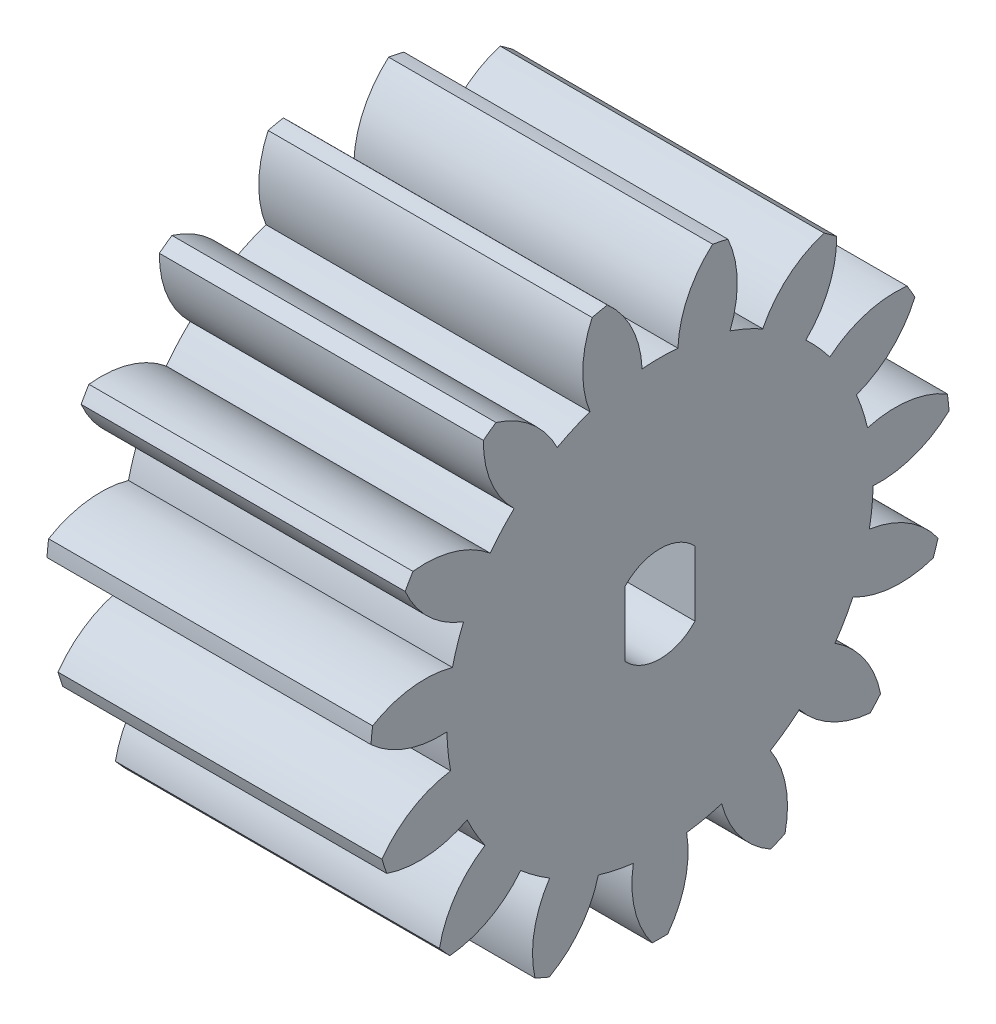
from build123d import *

# Parameters (mm, degrees)
BASPROSKE_W        = 19
BASPROSKE_H        = 17
TOOTHCUT_DEPTH     = 31.643106892
TEETHCUTS_COUNT    = 15
TEETHCUTS_ANGLE    = 336
BORSKE_R           = 0.4
BORE_DEPTH         = 50.0000508
CUT_EXTRUDE1_REACH = 32.615


with BuildPart() as part:
    # BasProSke → Base-Revolve (revolve)
    with BuildSketch(Plane(origin=(0, 0, 0), x_dir=(1, 0, 0), z_dir=(0, 1, 0)), mode=Mode.PRIVATE) as base_revolve_sk:
        with Locations((9.5, 8.5)):
            Rectangle(BASPROSKE_W, BASPROSKE_H)
    revolve(base_revolve_sk.sketch.rotate(Axis((-10, 0, 0), (1, 0, 0)), 180), axis=Axis((-10, 0, 0), (1, 0, 0)))

    # TooCutSke → ToothCut (cut, through all)
    with BuildSketch(Plane(origin=(0, 0, 0), x_dir=(0, 0, -1), z_dir=(1, 0, 0))):
        with BuildLine():
            ThreePointArc((1.050056448, 12.454813626), (0, 12.499), (-1.050056448, 12.454813626))
            ThreePointArc((-1.050056448, 12.454813626), (-1.638118106, 14.809604533), (-3.110934279, 16.73876737))
            ThreePointArc((-3.110934279, 16.73876737), (0, 17.0254), (3.110934279, 16.73876737))
            ThreePointArc((3.110934279, 16.73876737), (1.638118106, 14.809604533), (1.050056448, 12.454813626))
        make_face()
    toothcut = extrude(amount=TOOTHCUT_DEPTH, mode=Mode.SUBTRACT)

    # TeethCuts: ToothCut ×15 about axis
    teethcuts_axis = Axis((-10, 0, 0), (1, 0, 0))
    for i in range(1, TEETHCUTS_COUNT):
        add(toothcut.rotate(teethcuts_axis, i * TEETHCUTS_ANGLE / (TEETHCUTS_COUNT - 1)), mode=Mode.SUBTRACT)

    # BorSke → Bore (cut, symmetric)
    with BuildSketch(Plane(origin=(0, 0, 0), x_dir=(0, 0, -1), z_dir=(1, 0, 0))):
        with Locations(Location((0, 0, 0), (0, 0, 180))):
            Circle(BORSKE_R)
    extrude(amount=BORE_DEPTH, both=True, mode=Mode.SUBTRACT)

    # Sketch1 → Cut-Extrude1 (cut, up to next)
    with BuildSketch(Plane.ZY, mode=Mode.PRIVATE) as cut_extrude1_sk1:
        with BuildLine():
            Line((2.05, -1.907223112), (2.05, 1.907223112))
            ThreePointArc((2.05, 1.907223112), (0, 2.8), (-2.05, 1.907223112))
            Line((-2.05, 1.907223112), (-2.05, -1.907223112))
            ThreePointArc((-2.05, -1.907223112), (0, -2.8), (2.05, -1.907223112))
        make_face()
    cut_extrude1_tool1 = extrude(cut_extrude1_sk1.sketch, amount=-CUT_EXTRUDE1_REACH, mode=Mode.PRIVATE) & part.part
    add(cut_extrude1_tool1.solids().sort_by_distance((0, 0, 0))[0], mode=Mode.SUBTRACT)


solid = part.part
